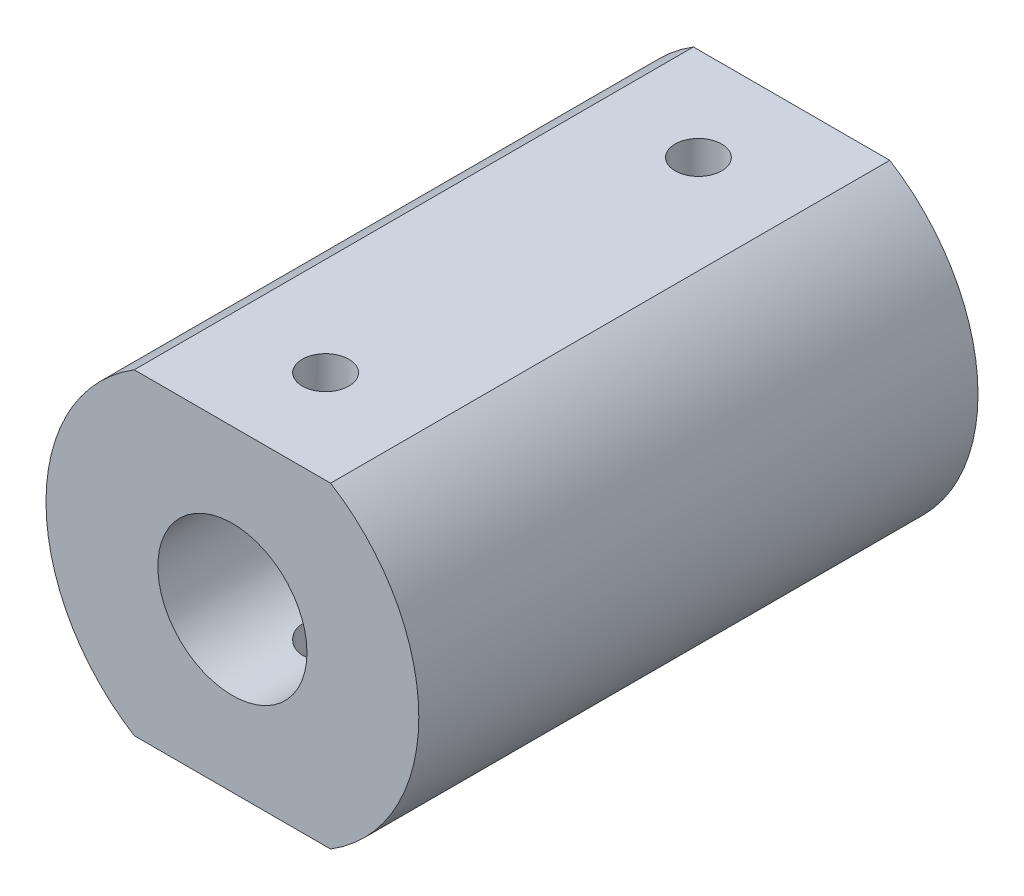
from build123d import *

# Parameters (mm, degrees)
ESQUISSE1_R             = 20
ESQUISSE1_R_2           = 8
BOSS_EXTRU_1_DEPTH      = 60
ESQUISSE2_W             = 40
ESQUISSE2_H             = 4.835178206
ESQUISSE2_W_2           = 44.689434038
ESQUISSE2_H_2           = 5.086258347
ENL_V_MAT_EXTRU_1_DEPTH = 60
TROU_TARAUD_M61_D       = 5
TROU_TARAUD_M61_DEPTH   = 13
TROU_TARAUD_M61_TIP     = 1.502151548
TROU_TARAUD_M62_D       = 5
TROU_TARAUD_M62_DEPTH   = 15
TROU_TARAUD_M62_TIP     = 1.502151548


with BuildPart() as part:
    # Esquisse1 → Boss.-Extru.1 (new body)
    with BuildSketch(Plane.XY):
        Circle(ESQUISSE1_R)
        Circle(ESQUISSE1_R_2, mode=Mode.SUBTRACT)
    extrude(amount=BOSS_EXTRU_1_DEPTH)

    # Esquisse2 → Enlèv. mat.-Extru.1 (cut)
    with BuildSketch(Plane.XY.offset(60)):
        with Locations((4.791370724, 19.417589103)):
            Rectangle(ESQUISSE2_W, ESQUISSE2_H)
        with Locations((-4.250423756, -19.543129173)):
            Rectangle(ESQUISSE2_W_2, ESQUISSE2_H_2)
    extrude(amount=-ENL_V_MAT_EXTRU_1_DEPTH, mode=Mode.SUBTRACT)

    # Trou taraudé M61
    with Locations(Plane(origin=(0, 17, 50), x_dir=(0, 0, 1), z_dir=(0, 1, 0))):
        with Locations((0, 0), (-40, 0)):
            Hole(TROU_TARAUD_M61_D / 2, depth=TROU_TARAUD_M61_DEPTH)
            with Locations((0, 0, -(TROU_TARAUD_M61_DEPTH + TROU_TARAUD_M61_TIP / 2))):  # 118° drill point
                Cone(0, TROU_TARAUD_M61_D / 2, TROU_TARAUD_M61_TIP, mode=Mode.SUBTRACT)

    # Trou taraudé M62
    with Locations(Plane(origin=(0, -17, 50), x_dir=(0, 0, -1), z_dir=(0, -1, 0))):
        with Locations((0, 0), (20, 0)):
            Hole(TROU_TARAUD_M62_D / 2, depth=TROU_TARAUD_M62_DEPTH)
            with Locations((0, 0, -(TROU_TARAUD_M62_DEPTH + TROU_TARAUD_M62_TIP / 2))):  # 118° drill point
                Cone(0, TROU_TARAUD_M62_D / 2, TROU_TARAUD_M62_TIP, mode=Mode.SUBTRACT)


solid = part.part
